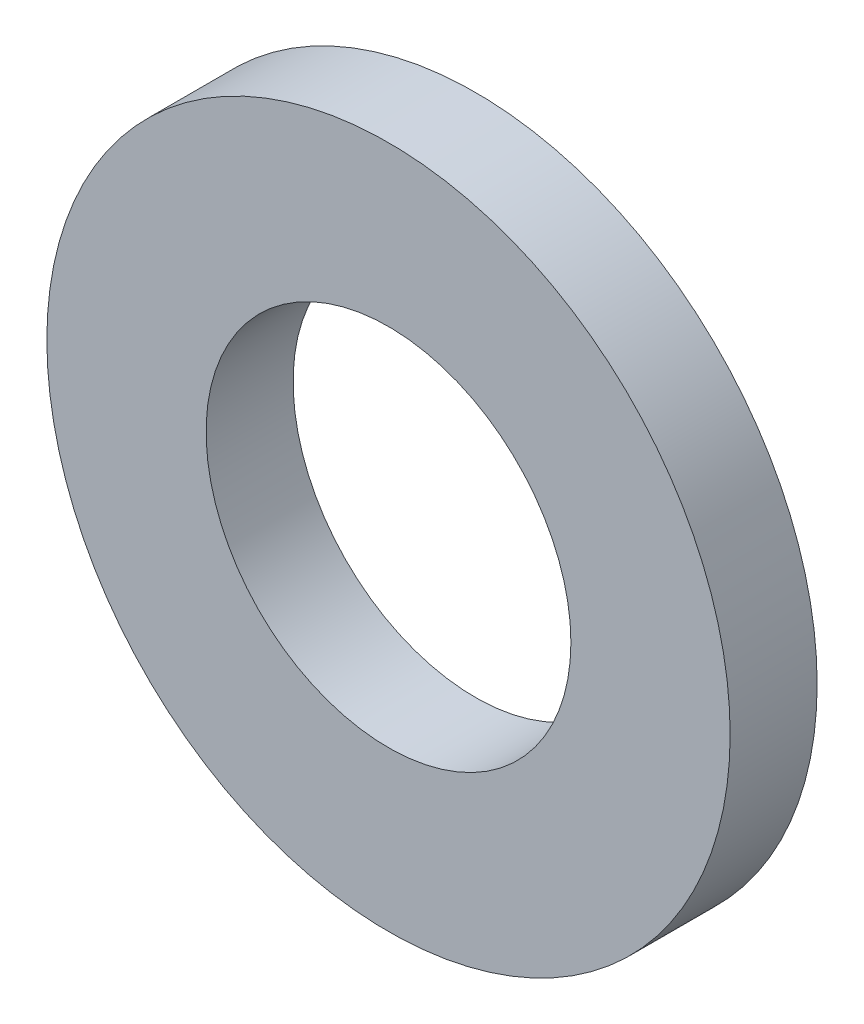
from build123d import *

# Parameters (mm, degrees)
SKETCH3_R           = 6.1849
SKETCH3_R_2         = 3.302
BOSS_EXTRUDE1_DEPTH = 1.5748


with BuildPart() as part:
    # Sketch3 → Boss-Extrude1 (new body)
    with BuildSketch(Plane.XY):
        Circle(SKETCH3_R)
        Circle(SKETCH3_R_2, mode=Mode.SUBTRACT)
    extrude(amount=BOSS_EXTRUDE1_DEPTH)


solid = part.part
